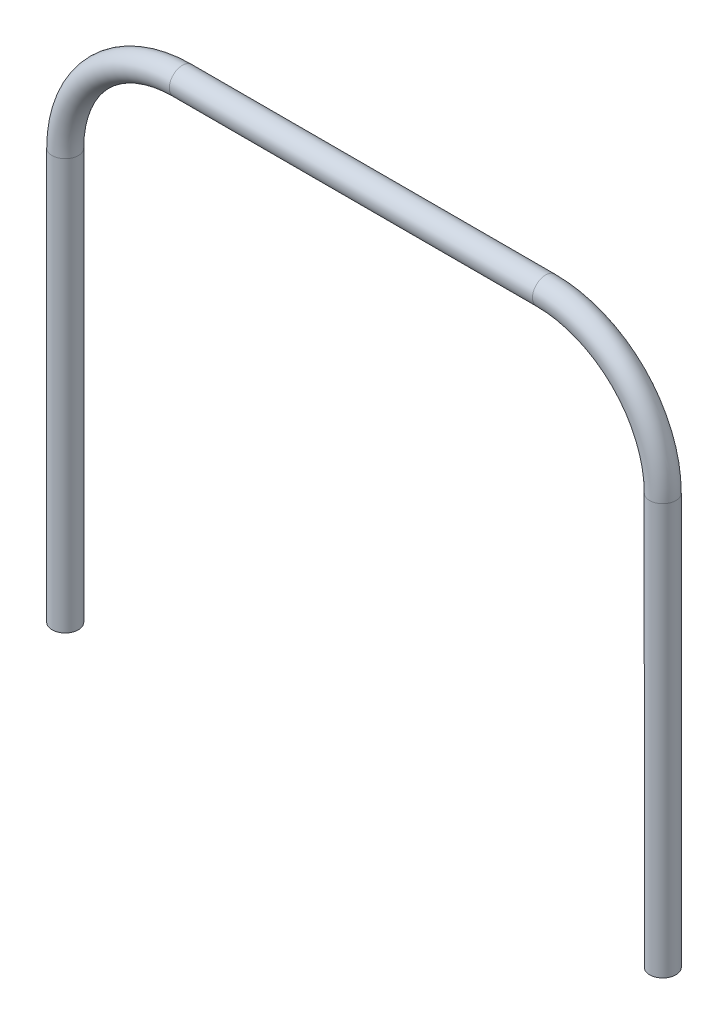
from build123d import *

# Parameters (mm, degrees)
SKETCH2_R   = 19
SKETCH2_R_2 = 17.8


with BuildPart() as part:
    # Sweep1: sweep along a path in Sketch1
    with BuildLine(Plane.XY) as sweep1_path:
        Line((0, 0), (0, 596))
        ThreePointArc((0, 596), (49.791847198, 716.208152802), (170, 766))
        Line((170, 766), (697, 766))
        ThreePointArc((697, 766), (817.208152802, 716.208152802), (867, 596))
        Line((867, 596), (867, 0))
    # Sketch2 → Sweep1 (sweep)
    with BuildSketch(Plane(origin=(0, 0, 0), x_dir=(1, 0, 0), z_dir=(0, 1, 0))):
        Circle(SKETCH2_R)
        Circle(SKETCH2_R_2, mode=Mode.SUBTRACT)
    sweep(path=sweep1_path.line)


solid = part.part
